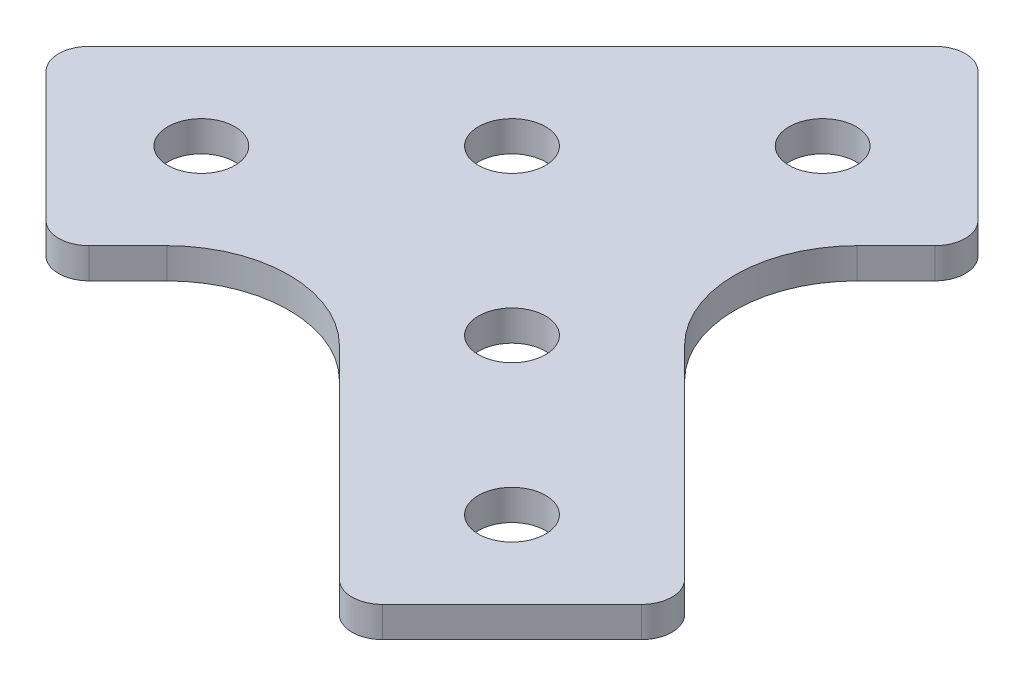
from build123d import *

# Parameters (mm, degrees)
BOSS_EXTRUDE1_DEPTH = 3.175
SKETCH2_R           = 3.4925
CUT_EXTRUDE2_DEPTH  = 3.175
LPATTERN5_COUNT     = 3
LPATTERN5_PITCH     = 22.86
SKETCH7_R           = 3.4925
CUT_EXTRUDE3_DEPTH  = 3.175
LPATTERN6_COUNT     = 2
LPATTERN6_PITCH     = 22.86
SKETCH8_R           = 3.4925
CUT_EXTRUDE4_DEPTH  = 85.115331985
FILLET3_R           = 12.7
FILLET4_R           = 3.175


with BuildPart() as part:
    # Sketch1 → Boss-Extrude1 (new body)
    with BuildSketch(Plane(origin=(0, 0, 0), x_dir=(1, 0, 0), z_dir=(0, 1, 0))):
        Polygon((-17.960512242, 17.960512242), (0, 35.921024484), (17.960512242, 17.960512242), (50.289434278, -14.368409794), (32.328922036, -32.328922036), (0, 0), (-31.430896424, -31.430896424), (-49.391408666, -13.470384182), align=None)
    extrude(amount=BOSS_EXTRUDE1_DEPTH)

    # Sketch2 → Cut-Extrude2 (cut)
    with BuildSketch(Plane(origin=(0, 3.175, 0), x_dir=(1, 0, 0), z_dir=(0, 1, 0))):
        with Locations(Location((-32.328922036, -14.368409794, 0), (0, 0, 270))):
            Circle(SKETCH2_R)
    cut_extrude2 = extrude(amount=-CUT_EXTRUDE2_DEPTH, mode=Mode.SUBTRACT)

    # LPattern5: Cut-Extrude2 ×3
    with Locations(*[Vector(0.7071067811865467, 0, -0.7071067811865485) * (i * LPATTERN5_PITCH) for i in range(1, LPATTERN5_COUNT)]):
        add(cut_extrude2, mode=Mode.SUBTRACT)

    # Sketch7 → Cut-Extrude3 (cut)
    with BuildSketch(Plane(origin=(0, 3.175, 0), x_dir=(1, 0, 0), z_dir=(0, 1, 0))):
        with Locations(Location((33.226947648, -15.266435406, 0), (0, 0, 270))):
            Circle(SKETCH7_R)
    cut_extrude3 = extrude(amount=-CUT_EXTRUDE3_DEPTH, mode=Mode.SUBTRACT)

    # LPattern6: Cut-Extrude3 ×2
    with Locations(*[Vector(-0.7071067811865457, 0, -0.7071067811865493) * (i * LPATTERN6_PITCH) for i in range(1, LPATTERN6_COUNT)]):
        add(cut_extrude3, mode=Mode.SUBTRACT)

    # Mirror2: part across plane


with BuildPart() as part_1:
    add(part.part)
    add(part.part.mirror(Plane(origin=(8.980256121, 0, -8.980256121), x_dir=(0.7071067811865464, 0, 0.7071067811865487), z_dir=(-0.7071067811865489, 0, 0.7071067811865462))))

    # Sketch8 → Cut-Extrude4 (cut, through all)
    # profile 1 of 2: a face of its own
    with BuildSketch(Plane(origin=(0, 3.175, 0), x_dir=(1, 0, 0), z_dir=(0, 1, 0))):
        Polygon((-15.266435406, -15.266435406), (-33.226947648, 2.694076836), (-49.391408666, -13.470384182), (-31.430896424, -31.430896424), align=None)
        with Locations((-32.328922036, -14.368409794)):
            Circle(SKETCH8_R, mode=Mode.SUBTRACT)
    # profile 2 of 2: a face of its own
    with BuildSketch(Plane(origin=(0, 3.175, 0), x_dir=(1, 0, 0), z_dir=(0, 1, 0))):
        Polygon((33.226947648, 33.226947648), (49.391408666, 49.391408666), (31.430896424, 67.351920908), (15.266435406, 51.18745989), align=None)
        with Locations((32.328922036, 50.289434278)):
            Circle(SKETCH8_R, mode=Mode.SUBTRACT)
    extrude(amount=-CUT_EXTRUDE4_DEPTH, mode=Mode.SUBTRACT)

    # Fillet3
    fillet3_edges = [part_1.edges().sort_by_distance(p)[0] for p in [
        (0, 1.5875, 0),
        (17.960512242, 1.5875, -17.960512242),
    ]]
    fillet(fillet3_edges, radius=FILLET3_R)

    # Fillet4
    fillet4_edges = [part_1.edges().sort_by_distance(p)[0] for p in [
        (15.266435406, 1.5875, -51.18745989),
        (33.226947648, 1.5875, -33.226947648),
        (50.289434278, 1.5875, 14.368409794),
        (32.328922036, 1.5875, 32.328922036),
        (-33.226947648, 1.5875, -2.694076836),
        (-15.266435406, 1.5875, 15.266435406),
    ]]
    fillet(fillet4_edges, radius=FILLET4_R)


solid = part_1.part
